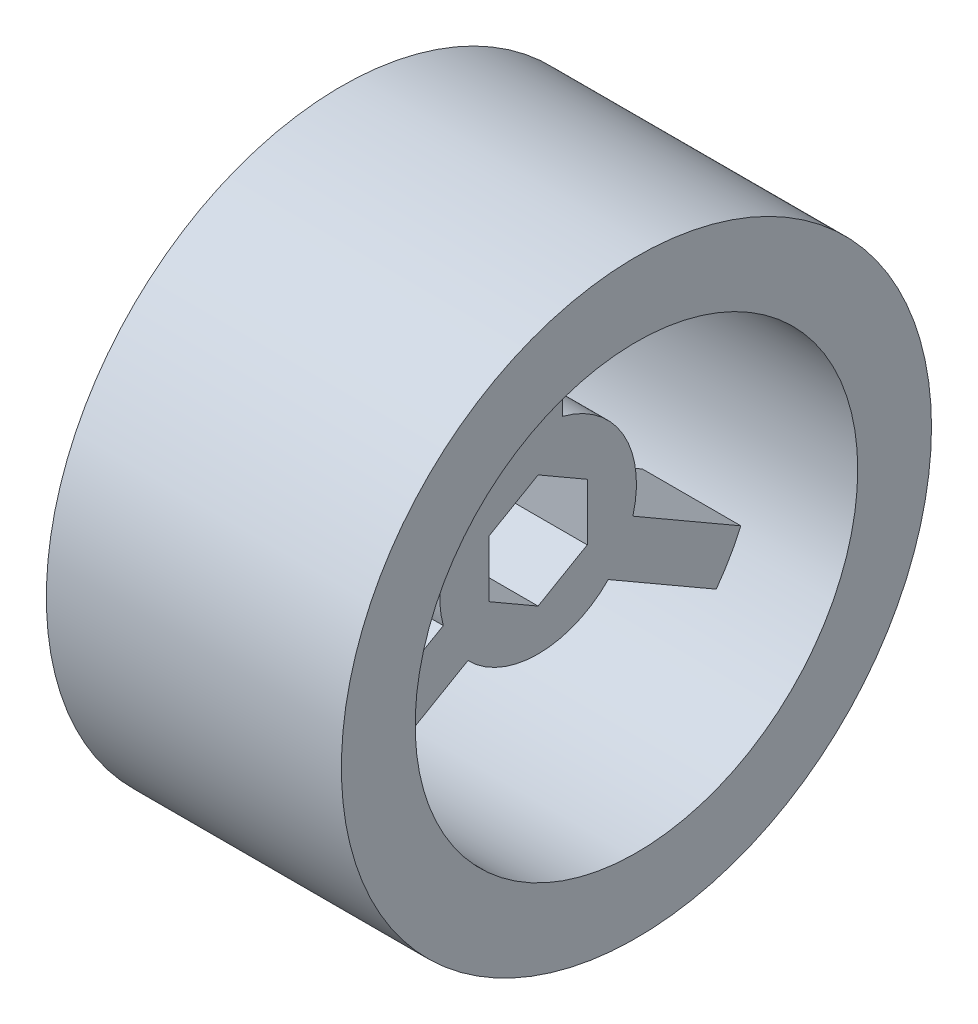
from build123d import *

# Parameters (mm, degrees)
BOSS_EXTRUDE1_DEPTH = 12.7
BOSS_EXTRUDE2_START = -38.1
SKETCH2_R           = 38.1
SKETCH2_R_2         = 28.575
BOSS_EXTRUDE2_DEPTH = 38.1
CUT_EXTRUDE1_DEPTH  = 38.1


with BuildPart() as part:
    # Sketch1 → Boss-Extrude1 (new body)
    with BuildSketch(Plane(origin=(0, 0, 0), x_dir=(0, 0, -1), z_dir=(1, 0, 0))):
        with BuildLine():
            ThreePointArc((3.175, 28.398063314), (0, 28.575), (-3.175, 28.398063314))
            Line((-3.175, 28.398063314), (-3.175, 12.296722124))
            ThreePointArc((-3.175, 12.296722124), (-10.998522628, 6.35), (-12.236773743, -3.398730405))
            Line((-12.236773743, -3.398730405), (-26.180944248, -11.449401))
            ThreePointArc((-26.180944248, -11.449401), (-24.746675913, -14.2875), (-23.005944248, -16.948662314))
            Line((-23.005944248, -16.948662314), (-9.061773743, -8.897991719))
            ThreePointArc((-9.061773743, -8.897991719), (0, -12.7), (9.061773743, -8.897991719))
            Line((9.061773743, -8.897991719), (23.005944248, -16.948662314))
            ThreePointArc((23.005944248, -16.948662314), (24.746675913, -14.2875), (26.180944248, -11.449401))
            Line((26.180944248, -11.449401), (12.236773743, -3.398730405))
            ThreePointArc((12.236773743, -3.398730405), (10.998522628, 6.35), (3.175, 12.296722124))
            Line((3.175, 12.296722124), (3.175, 28.398063314))
        make_face()
    extrude(amount=BOSS_EXTRUDE1_DEPTH)

    # Sketch2 → Boss-Extrude2 (add)
    with BuildSketch(Plane(origin=(25.4, 0, 0), x_dir=(0, 0, -1), z_dir=(1, 0, 0)).offset(BOSS_EXTRUDE2_START)):
        Circle(SKETCH2_R)
        Circle(SKETCH2_R_2, mode=Mode.SUBTRACT)
    extrude(amount=BOSS_EXTRUDE2_DEPTH)

    # Sketch3 → Cut-Extrude1 (cut)
    with BuildSketch(Plane(origin=(12.7, 0, 0), x_dir=(0, 0, -1), z_dir=(1, 0, 0))):
        Polygon((0, 7.332348419), (-6.35, 3.666174209), (-6.35, -3.666174209), (0, -7.332348419), (6.35, -3.666174209), (6.35, 3.666174209), align=None)
    extrude(amount=-CUT_EXTRUDE1_DEPTH, mode=Mode.SUBTRACT)


solid = part.part
